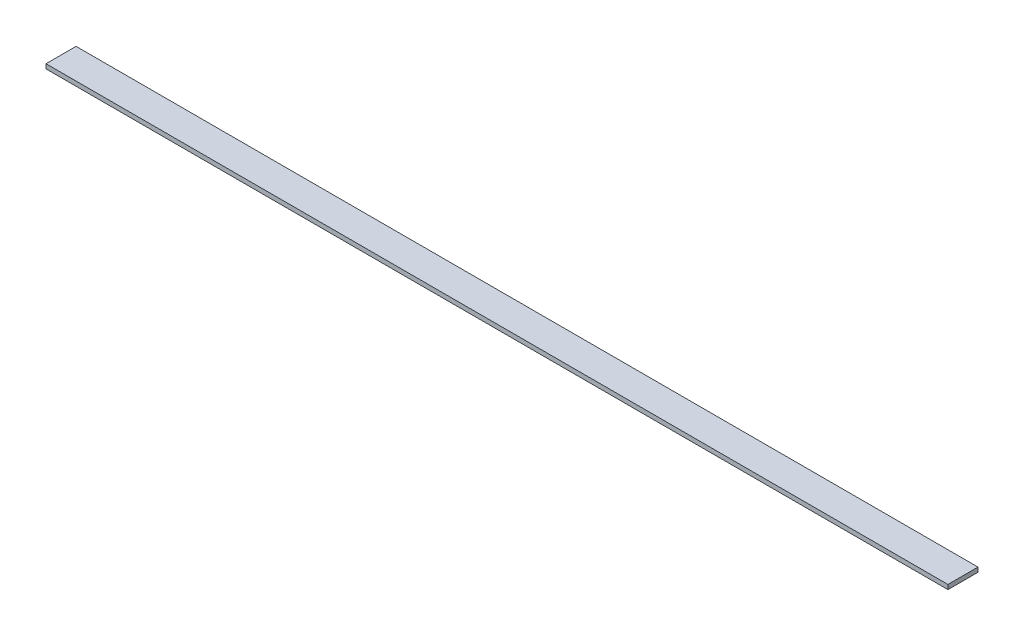
from build123d import *

# Parameters (mm, degrees)
SKETCH1_W           = 600
SKETCH1_H           = 20
BOSS_EXTRUDE1_DEPTH = 3


with BuildPart() as part:
    # Sketch1 → Boss-Extrude1 (new body)
    with BuildSketch(Plane(origin=(0, 0, 0), x_dir=(1, 0, 0), z_dir=(0, 1, 0))):
        with Locations((-76.29407925, 220.27622251)):
            Rectangle(SKETCH1_W, SKETCH1_H)
    extrude(amount=BOSS_EXTRUDE1_DEPTH)


solid = part.part
